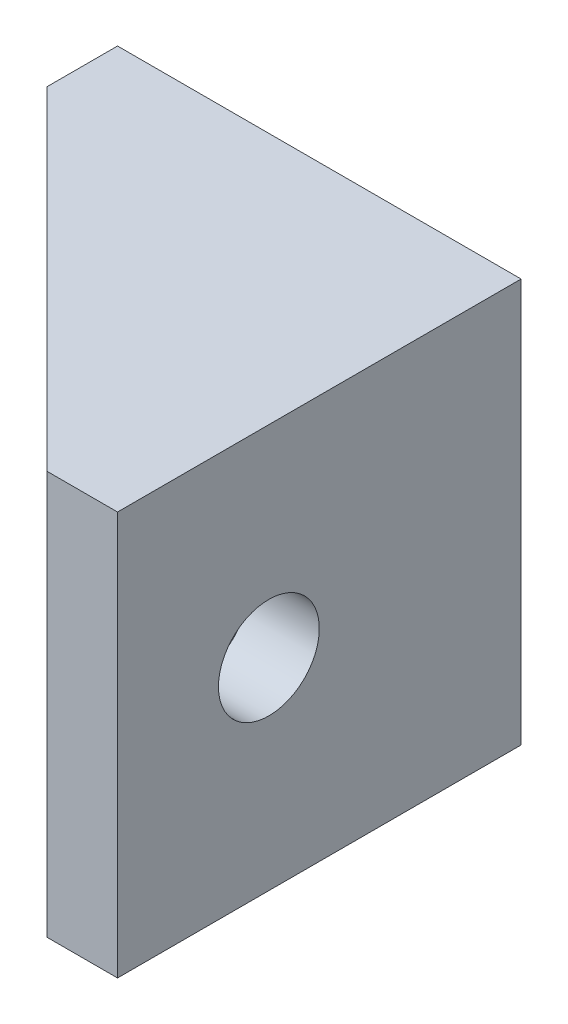
from build123d import *

# Parameters (mm, degrees)
SKETCH1_W               = 20
SKETCH1_H               = 20
BOSS_EXTRUDE1_DEPTH     = 20
SKETCH2_W               = 16.5
SKETCH2_H               = 16
CUT_EXTRUDE1_DEPTH      = 16.5
CUT_EXTRUDE2_DEPTH      = 34.526109228
CUT_EXTRUDE2_DEPTH_BACK = 34.526109228
CUT_EXTRUDE3_DEPTH      = 33.74522866
CUT_EXTRUDE3_DEPTH_BACK = 33.74522866
SKETCH4_R               = 2.5
CUT_EXTRUDE4_DEPTH      = 33.74522866
CUT_EXTRUDE4_DEPTH_BACK = 33.74522866
SKETCH5_R               = 2.5


with BuildPart() as part:
    # Sketch1 → Boss-Extrude1 (new body)
    with BuildSketch(Plane(origin=(0, 0, 0), x_dir=(1, 0, 0), z_dir=(0, 1, 0))):
        with Locations((-10, 10)):
            Rectangle(SKETCH1_W, SKETCH1_H)
    extrude(amount=BOSS_EXTRUDE1_DEPTH)

    # Sketch2 → Cut-Extrude1 (cut)
    with BuildSketch(Plane.ZY.offset(20)):
        with Locations((-8.25, 10)):
            Rectangle(SKETCH2_W, SKETCH2_H)
    extrude(amount=-CUT_EXTRUDE1_DEPTH, mode=Mode.SUBTRACT)

    # Sketch3 → Cut-Extrude2 (cut, two sides: drawn at the far end of the back side and taken through both)
    with BuildSketch(Plane(origin=(0, 18, 0), x_dir=(-1, 0, 0), z_dir=(0, -1, 0)).offset(-CUT_EXTRUDE2_DEPTH_BACK)):
        Polygon((63.738492046, 60.238492046), (20, 16.5), (3.5, 0), (-40.238492046, -43.738492046), (47.238492046, -131.215476139), (151.215476139, -27.238492046), align=None)
    extrude(amount=CUT_EXTRUDE2_DEPTH + CUT_EXTRUDE2_DEPTH_BACK, mode=Mode.SUBTRACT)

    # Sketch4 → Cut-Extrude3 (cut, two sides: drawn at the far end of the back side and taken through both)
    with BuildSketch(Plane.ZY.offset(3.5).offset(-CUT_EXTRUDE3_DEPTH_BACK)):
        with Locations((-7.5, 10)):
            Circle(SKETCH4_R)
    extrude(amount=CUT_EXTRUDE3_DEPTH + CUT_EXTRUDE3_DEPTH_BACK, mode=Mode.SUBTRACT)

    # Sketch5 → Cut-Extrude4 (cut, two sides: drawn at the far end of the back side and taken through both)
    with BuildSketch(Plane.XY.offset(-16.5).offset(-CUT_EXTRUDE4_DEPTH_BACK)):
        with Locations((-12.5, 10)):
            Circle(SKETCH5_R)
    extrude(amount=CUT_EXTRUDE4_DEPTH + CUT_EXTRUDE4_DEPTH_BACK, mode=Mode.SUBTRACT)


solid = part.part
